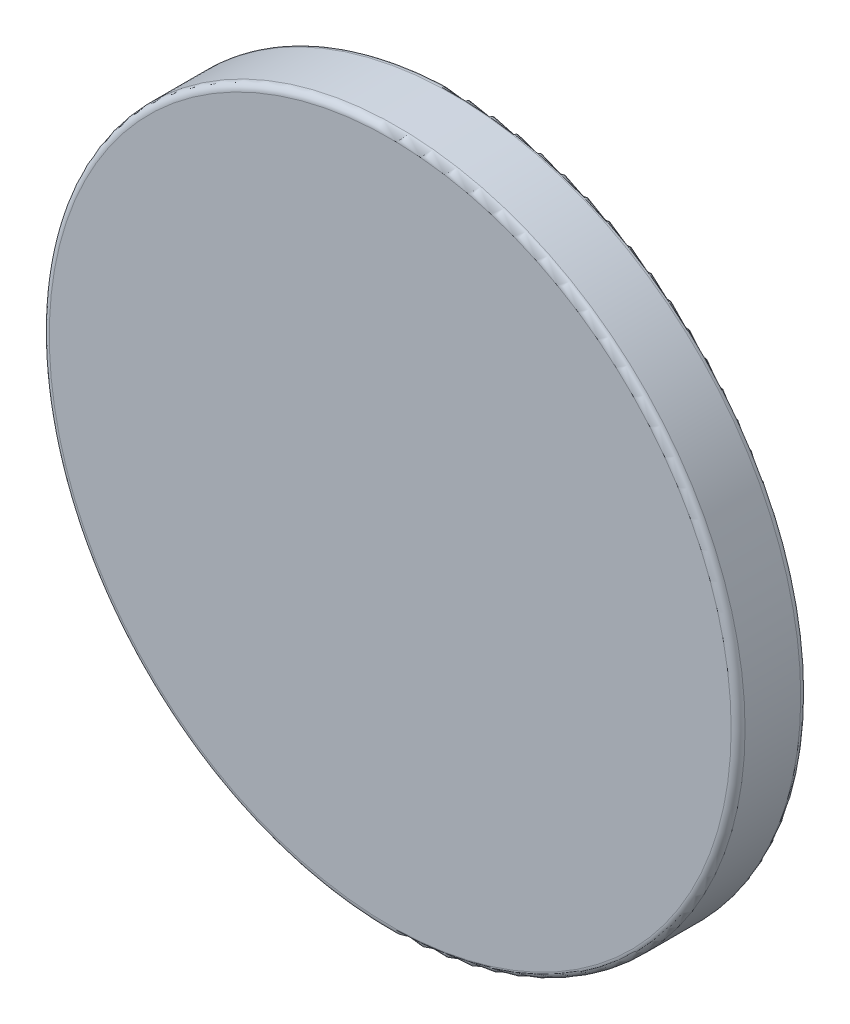
from build123d import *

# Parameters (mm, degrees)
SKETCH1_R           = 50
BOSS_EXTRUDE1_DEPTH = 10
FILLET1_R           = 1


with BuildPart() as part:
    # Sketch1 → Boss-Extrude1 (new body)
    with BuildSketch(Plane.XY):
        Circle(SKETCH1_R)
    extrude(amount=BOSS_EXTRUDE1_DEPTH)

    # Fillet1
    fillet1_edges = [part.edges().sort_by_distance(p)[0] for p in [
        (-50, 0, 0),
        (-50, 0, 10),
    ]]
    fillet(fillet1_edges, radius=FILLET1_R)


solid = part.part
